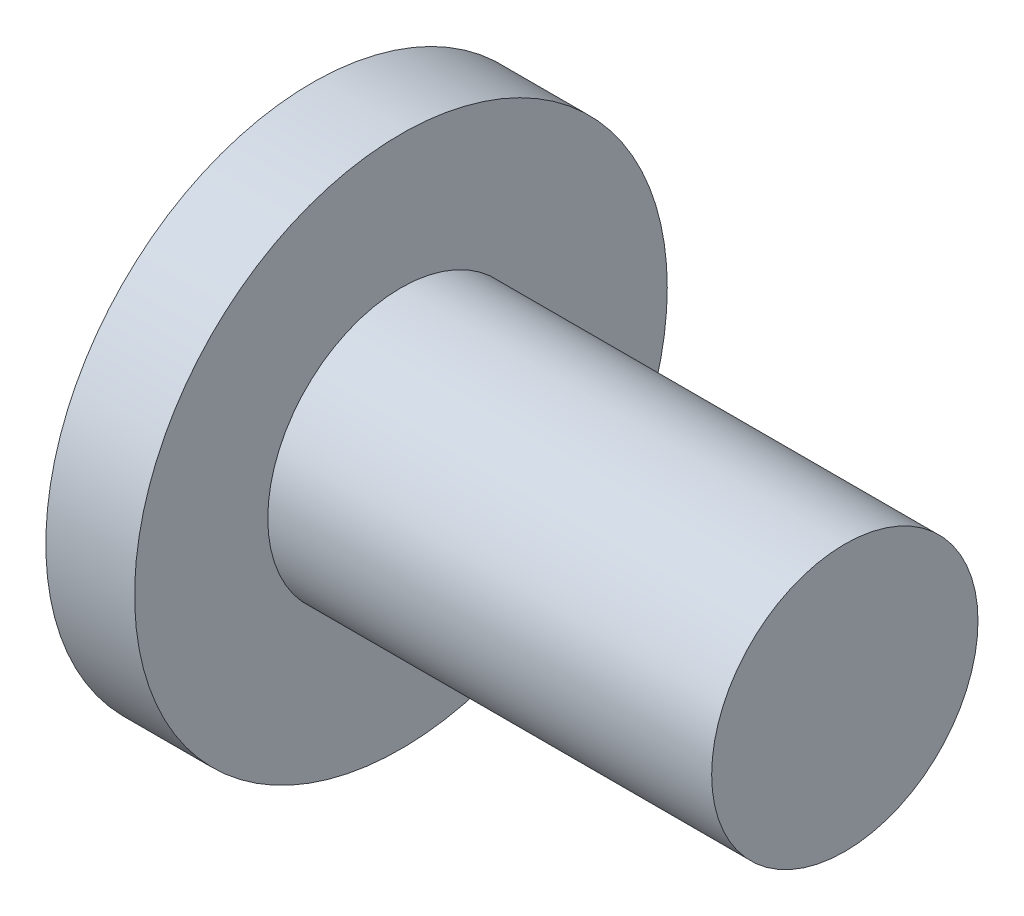
from build123d import *


with BuildPart() as part:
    # Sketch1 → Revolve1 (revolve)
    with BuildSketch(Plane(origin=(0, 0, 0), x_dir=(1, 0, 0), z_dir=(0, 1, 0))):
        Polygon((0, 0), (-304.8, 0), (-304.8, 152.4), (-254, 152.4), (-254, 76.2), (0, 76.2), align=None)
    revolve(axis=Axis((0, 0, 0), (-1, 0, 0)))


solid = part.part
